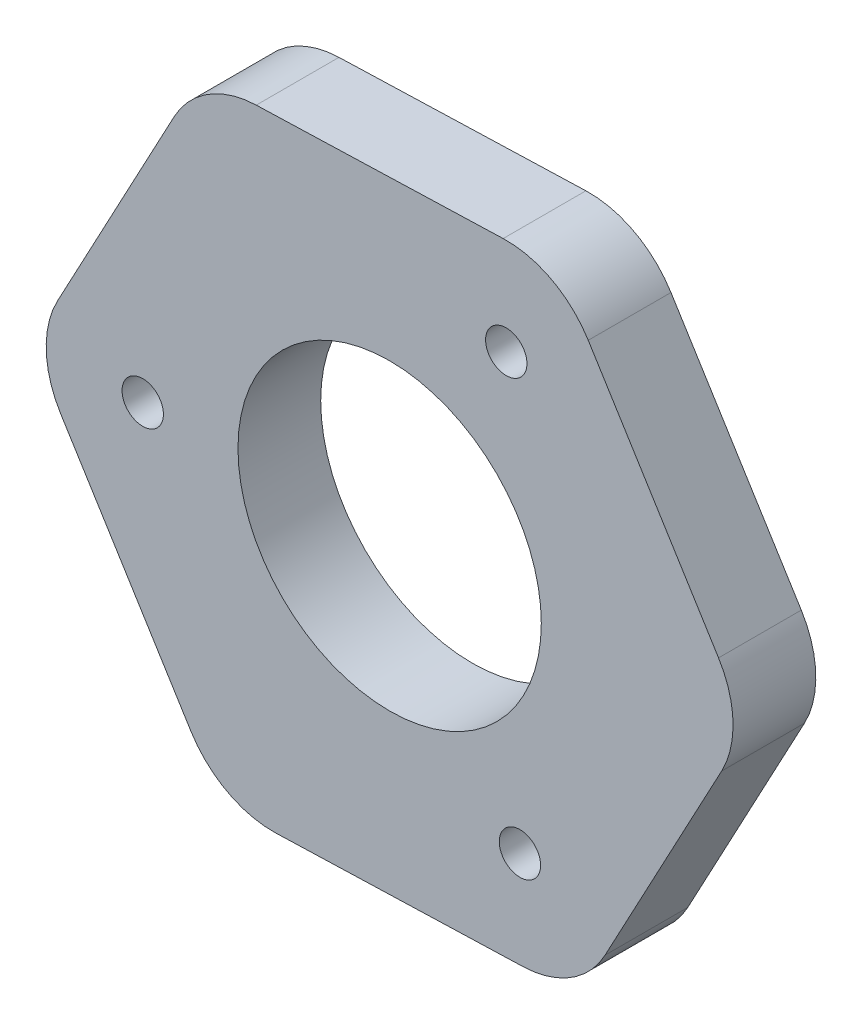
from build123d import *

# Parameters (mm, degrees)
SKETCH1_R           = 1.5
SKETCH1_R_2         = 11
BOSS_EXTRUDE1_DEPTH = 6


with BuildPart() as part:
    # Sketch1 → Boss-Extrude1 (new body)
    with BuildSketch(Plane.XY):
        with BuildLine():
            Line((56.541482216, 380.962770721), (38.633561304, 380.389441887))
            ThreePointArc((38.633561304, 380.389441887), (35.165363003, 379.340103535), (32.686484345, 376.697250714))
            Line((32.686484345, 376.697250714), (24.229041225, 360.901871858))
            ThreePointArc((24.229041225, 360.901871858), (23.403695744, 357.373654848), (24.453034097, 353.905456547))
            Line((24.453034097, 353.905456547), (33.903511888, 338.683406525))
            ThreePointArc((33.903511888, 338.683406525), (36.546364709, 336.204527868), (40.074581718, 335.379182388))
            Line((40.074581718, 335.379182388), (57.982502631, 335.952511222))
            ThreePointArc((57.982502631, 335.952511222), (61.450700931, 337.001849574), (63.929579589, 339.644702395))
            Line((63.929579589, 339.644702395), (72.38702271, 355.440081251))
            ThreePointArc((72.38702271, 355.440081251), (73.21236819, 358.968298261), (72.163029838, 362.436496561))
            Line((72.163029838, 362.436496561), (62.712552046, 377.658546583))
            ThreePointArc((62.712552046, 377.658546583), (60.069699226, 380.137425241), (56.541482216, 380.962770721))
        make_face()
        with Locations((57.758509759, 342.948926532)):
            Circle(SKETCH1_R, mode=Mode.SUBTRACT)
        with Locations((56.765475088, 373.966355411)):
            Circle(SKETCH1_R, mode=Mode.SUBTRACT)
        with Locations((30.400111055, 357.59764772)):
            Circle(SKETCH1_R, mode=Mode.SUBTRACT)
        with Locations((48.308031967, 358.170976554)):
            Circle(SKETCH1_R_2, mode=Mode.SUBTRACT)
    extrude(amount=BOSS_EXTRUDE1_DEPTH)


solid = part.part
